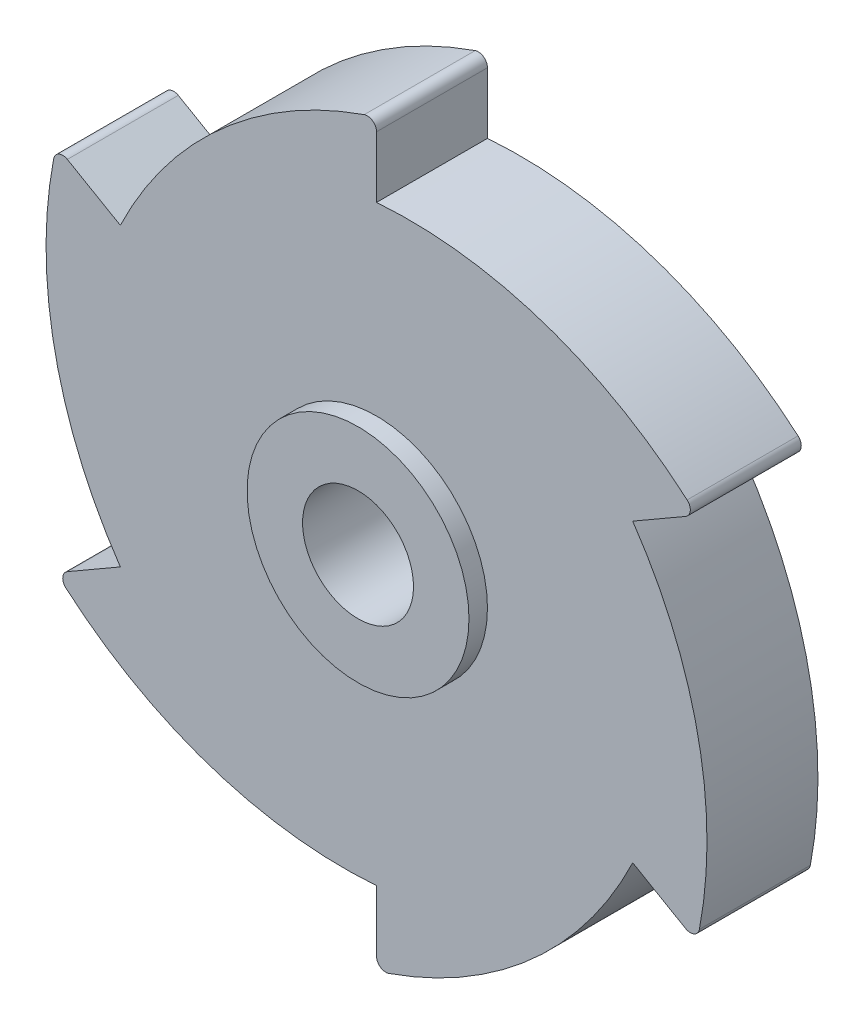
from build123d import *

# Parameters (mm, degrees)
SKETCH1_R               = 20
BOSS_EXTRUDE1_DEPTH     = 6
CUT_EXTRUDE1_DEPTH      = 29.91366459
CIRPATTERN1_COUNT       = 6
FILLET1_R               = 0.5
SKETCH4_R               = 6.01463831
BOSS_EXTRUDE2_DEPTH     = 1
SKETCH8_R               = 6
BOSS_EXTRUDE3_DEPTH     = 1
SKETCH9_R               = 6
CUT_EXTRUDE3_DEPTH      = 1
CUT_EXTRUDE4_DEPTH      = 28.583203303
CUT_EXTRUDE4_DEPTH_BACK = 28.583203303
SKETCH10_R              = 3


with BuildPart() as part:
    # Sketch1 → Boss-Extrude1 (new body)
    with BuildSketch(Plane.XY):
        Circle(SKETCH1_R)
    extrude(amount=BOSS_EXTRUDE1_DEPTH)

    # Sketch2 → Cut-Extrude1 (cut, symmetric)
    with BuildSketch(Plane.XY.offset(6)):
        with BuildLine():
            Line((0, 16), (0, 20))
            ThreePointArc((0, 20), (10, 17.320508076), (17.320508076, 10))
            ThreePointArc((17.320508076, 10), (9.283804095, 14.800033966), (0, 16))
        make_face()
    cut_extrude1 = extrude(amount=CUT_EXTRUDE1_DEPTH, both=True, mode=Mode.SUBTRACT)

    # CirPattern1: Cut-Extrude1 ×6 about axis
    cirpattern1_axis = Axis((0, 0, 0), (0, 0, 1))
    for i in range(1, CIRPATTERN1_COUNT):
        add(cut_extrude1.rotate(cirpattern1_axis, i * 360 / CIRPATTERN1_COUNT), mode=Mode.SUBTRACT)

    # Fillet1
    fillet1_edges = [part.edges().sort_by_distance(p)[0] for p in [
        (17.320508076, 10, 3),
        (0, 20, 3),
        (-17.320508076, 10, 3),
        (0, -20, 3),
        (-17.320508076, -10, 3),
        (17.320508076, -10, 3),
    ]]
    fillet(fillet1_edges, radius=FILLET1_R)

    # Sketch4 → Boss-Extrude2 (add)
    with BuildSketch(Plane.XY):
        Circle(SKETCH4_R)
    extrude(amount=BOSS_EXTRUDE2_DEPTH)

    # Sketch8 → Boss-Extrude3 (add)
    with BuildSketch(Plane.XY.offset(6)):
        Circle(SKETCH8_R)
    extrude(amount=BOSS_EXTRUDE3_DEPTH)

    # Sketch9 → Cut-Extrude3 (cut)
    with BuildSketch(Plane(origin=(0, 0, 0), x_dir=(-1, 0, 0), z_dir=(0, 0, -1))):
        with Locations(Location((0, 0, 0), (0, 0, 180))):
            Circle(SKETCH9_R)
    extrude(amount=-CUT_EXTRUDE3_DEPTH, mode=Mode.SUBTRACT)

    # Sketch10 → Cut-Extrude4 (cut, two sides: drawn at the far end of the back side and taken through both)
    with BuildSketch(Plane.XY.offset(7).offset(-CUT_EXTRUDE4_DEPTH_BACK)):
        Circle(SKETCH10_R)
    extrude(amount=CUT_EXTRUDE4_DEPTH + CUT_EXTRUDE4_DEPTH_BACK, mode=Mode.SUBTRACT)


solid = part.part
